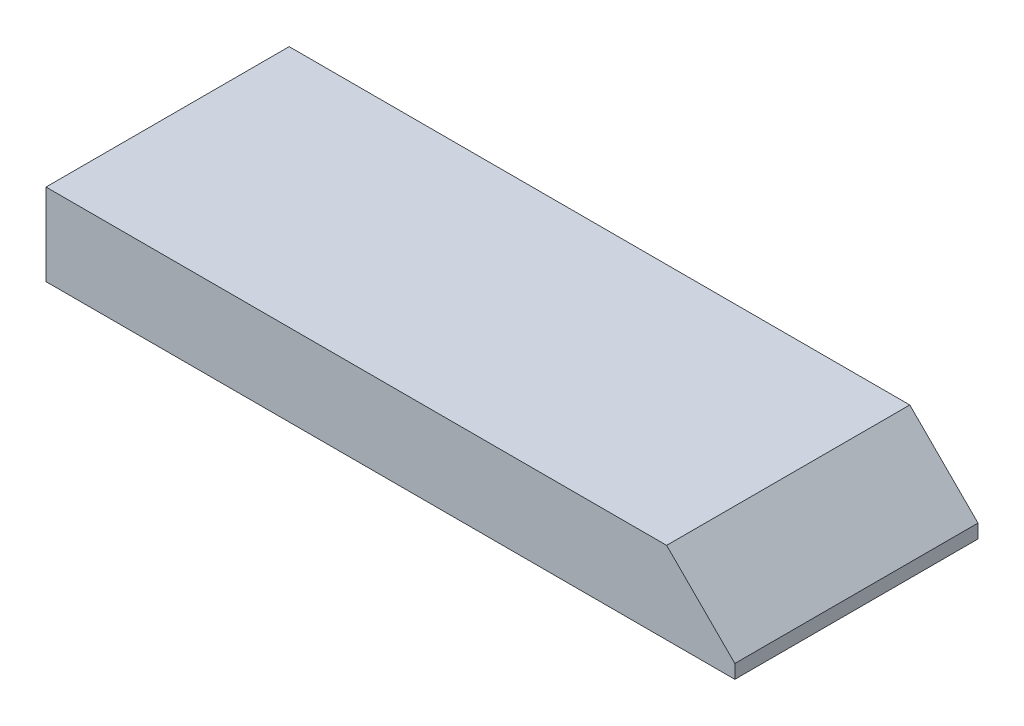
from build123d import *

# Parameters (mm, degrees)
BOSS_EXTRUDE1_DEPTH = 35.3


with BuildPart() as part:
    # Sketch1 → Boss-Extrude1 (new body)
    with BuildSketch(Plane.XY):
        Polygon((100, -9.899494937), (90.100505063, 0), (0, 0), (0, -11.899494937), (100, -11.899494937), align=None)
    extrude(amount=BOSS_EXTRUDE1_DEPTH)


solid = part.part
